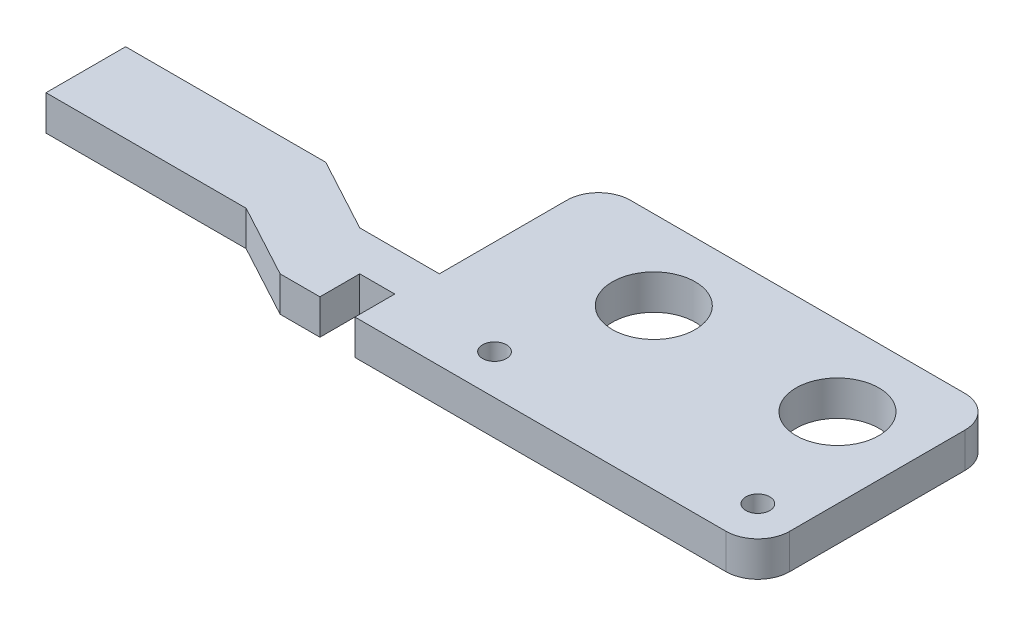
from build123d import *

# Parameters (mm, degrees)
BOSS_EXTRUDE1_DEPTH = 2.794
SKETCH2_R           = 0.9525
SKETCH2_R_2         = 3.302
CUT_EXTRUDE1_DEPTH  = 63.960241994
FILLET2_R           = 2.54


with BuildPart() as part:
    # Sketch1 → Boss-Extrude1 (new body)
    with BuildSketch(Plane(origin=(0, 0, 0), x_dir=(1, 0, 0), z_dir=(0, 1, 0))):
        Polygon((59.944, 0), (27.813, 0), (27.813, 3.175), (25.019, 3.175), (25.019, 0), (21.844, 0), (15.961568831, 3.175), (0, 3.175), (0, 9.525), (15.961568831, 9.525), (21.844, 6.35), (28.194, 6.35), (28.194, 19.05), (59.944, 19.05), align=None)
    extrude(amount=BOSS_EXTRUDE1_DEPTH)

    # Sketch2 → Cut-Extrude1 (cut, through all)
    with BuildSketch(Plane(origin=(0, 2.794, 0), x_dir=(1, 0, 0), z_dir=(0, 1, 0))):
        with Locations((56.769, 3.175)):
            Circle(SKETCH2_R)
        with Locations((35.769, 3.175)):
            Circle(SKETCH2_R)
        with Locations((53.594, 12.7)):
            Circle(SKETCH2_R_2)
        with Locations((38.944, 12.7)):
            Circle(SKETCH2_R_2)
    extrude(amount=-CUT_EXTRUDE1_DEPTH, mode=Mode.SUBTRACT)

    # Fillet2
    fillet2_edges = [part.edges().sort_by_distance(p)[0] for p in [
        (59.944, 1.397, 0),
        (59.944, 1.397, -19.05),
        (28.194, 1.397, -19.05),
    ]]
    fillet(fillet2_edges, radius=FILLET2_R)


solid = part.part
